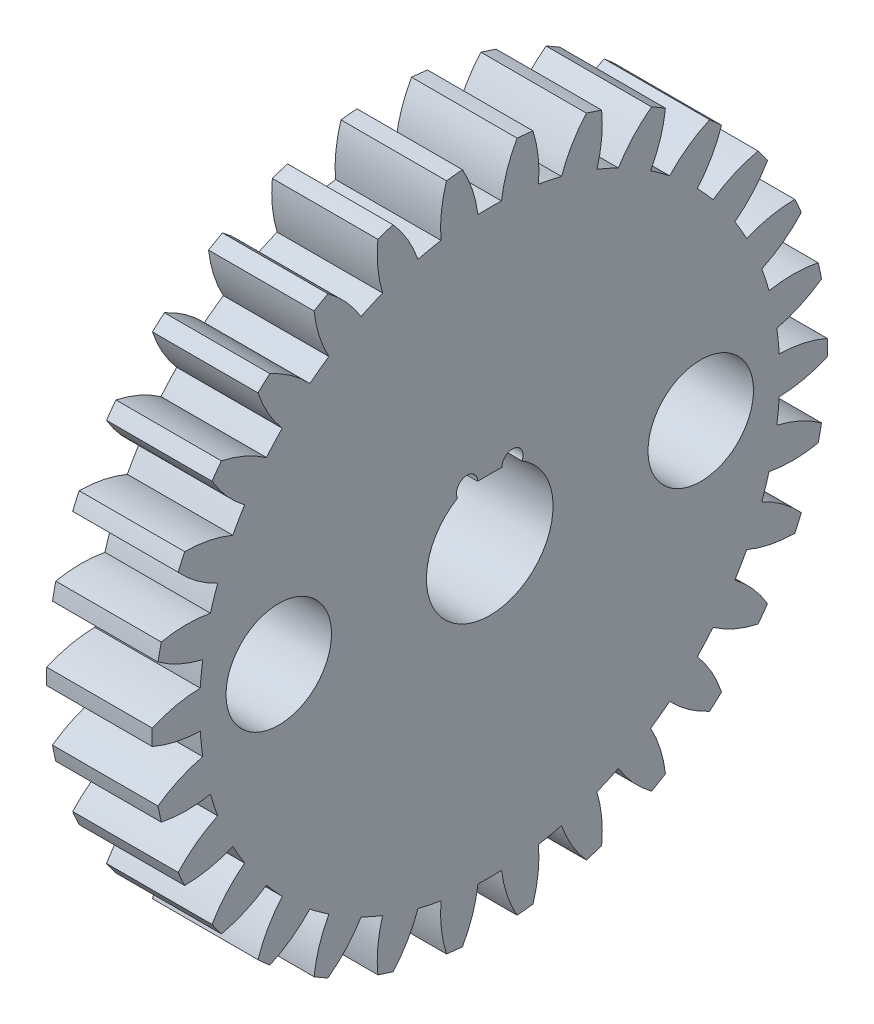
from build123d import *

# Parameters (mm, degrees)
BASPROSKE_W         = 2.5
BASPROSKE_H         = 8
TOOTHCUT_DEPTH      = 12.586630226
TEETHCUTS_COUNT     = 30
TEETHCUTS_ANGLE     = 348
BORSKE_R            = 1.5
BORE_DEPTH          = 50.0000508
SKETCH_3_R          = 1.25
CUT_EXTRUDE_1_DEPTH = 12.568528524
EXTRUDE_1_DEPTH     = 2.5
SKETCH_5_R          = 0.25
CUT_EXTRUDE_2_DEPTH = 12.568528524


with BuildPart() as part:
    # BasProSke → Base-Revolve (revolve)
    with BuildSketch(Plane(origin=(0, 0, 0), x_dir=(1, 0, 0), z_dir=(0, 1, 0)), mode=Mode.PRIVATE) as base_revolve_sk:
        with Locations((1.25, 4)):
            Rectangle(BASPROSKE_W, BASPROSKE_H)
    revolve(base_revolve_sk.sketch.rotate(Axis((-10, 0, 0), (1, 0, 0)), 180), axis=Axis((-10, 0, 0), (1, 0, 0)))

    # TooCutSke → ToothCut (cut, through all)
    with BuildSketch(Plane(origin=(0, 0, 0), x_dir=(0, 0, -1), z_dir=(1, 0, 0))):
        with BuildLine():
            ThreePointArc((0.279013782, 6.868335119), (0, 6.874), (-0.279013782, 6.868335119))
            ThreePointArc((-0.279013782, 6.868335119), (-0.413500328, 7.452412324), (-0.661410108, 7.998098638))
            ThreePointArc((-0.661410108, 7.998098638), (0, 8.0254), (0.661410108, 7.998098638))
            ThreePointArc((0.661410108, 7.998098638), (0.413500328, 7.452412324), (0.279013782, 6.868335119))
        make_face()
    toothcut = extrude(amount=TOOTHCUT_DEPTH, mode=Mode.SUBTRACT)

    # TeethCuts: ToothCut ×30 about axis
    teethcuts_axis = Axis((-10, 0, 0), (1, 0, 0))
    for i in range(1, TEETHCUTS_COUNT):
        add(toothcut.rotate(teethcuts_axis, i * TEETHCUTS_ANGLE / (TEETHCUTS_COUNT - 1)), mode=Mode.SUBTRACT)

    # BorSke → Bore (cut, symmetric)
    with BuildSketch(Plane(origin=(0, 0, 0), x_dir=(0, 0, -1), z_dir=(1, 0, 0))):
        with Locations(Location((0, 0, 0), (0, 0, 180))):
            Circle(BORSKE_R)
    extrude(amount=BORE_DEPTH, both=True, mode=Mode.SUBTRACT)

    # 草图3 → 切除-拉伸1 (cut, through all)
    with BuildSketch(Plane.ZY):
        with Locations((-5, 0)):
            Circle(SKETCH_3_R)
        with Locations((5, 0)):
            Circle(SKETCH_3_R)
    extrude(amount=-CUT_EXTRUDE_1_DEPTH, mode=Mode.SUBTRACT)

    # 草图4 → 凸台-拉伸1 (add, through all)
    with BuildSketch(Plane.ZY):
        with BuildLine():
            Line((-0.538516481, 1.4), (0.538516481, 1.4))
            ThreePointArc((0.538516481, 1.4), (0, 1.5), (-0.538516481, 1.4))
        make_face()
    extrude(amount=-EXTRUDE_1_DEPTH)

    # 草图5 → 切除-拉伸2 (cut, through all)
    with BuildSketch(Plane.ZY):
        with Locations((-0.538516481, 1.4)):
            Circle(SKETCH_5_R)
        with Locations((0.538516481, 1.4)):
            Circle(SKETCH_5_R)
    extrude(amount=-CUT_EXTRUDE_2_DEPTH, mode=Mode.SUBTRACT)


solid = part.part
